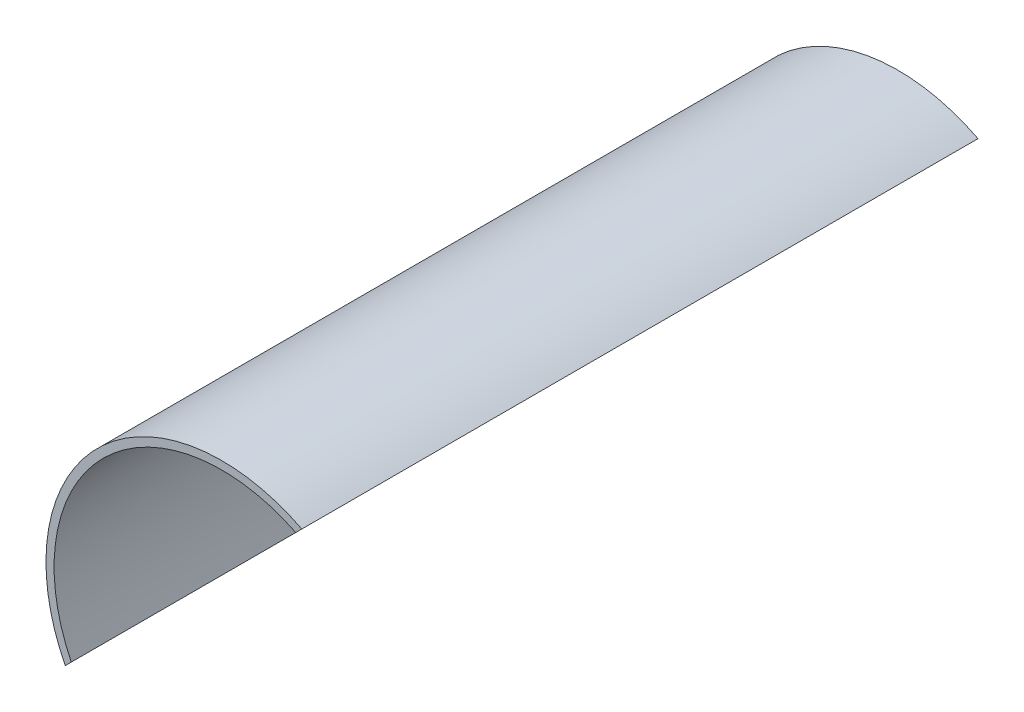
from build123d import *

# Parameters (mm, degrees)
SKETCH1_R           = 65
SKETCH1_R_2         = 62
BOSS_EXTRUDE1_DEPTH = 250
SKETCH4_W           = 130
SKETCH4_H           = 250
CUT_EXTRUDE4_DEPTH  = 516


with BuildPart() as part:
    # Sketch1 → Boss-Extrude1 (new body)
    with BuildSketch(Plane.XY):
        Circle(SKETCH1_R)
        Circle(SKETCH1_R_2, mode=Mode.SUBTRACT)
    extrude(amount=BOSS_EXTRUDE1_DEPTH)

    # Sketch4 → Cut-Extrude4 (cut)
    with BuildSketch(Plane(origin=(-14.142135624, 14.142135624, 0), x_dir=(0.7071067811865477, 0.7071067811865475, 0), z_dir=(-0.7071067811865475, 0.7071067811865477, 0))):
        with Locations((0, -125)):
            Rectangle(SKETCH4_W, SKETCH4_H)
    extrude(amount=-CUT_EXTRUDE4_DEPTH, mode=Mode.SUBTRACT)


solid = part.part
